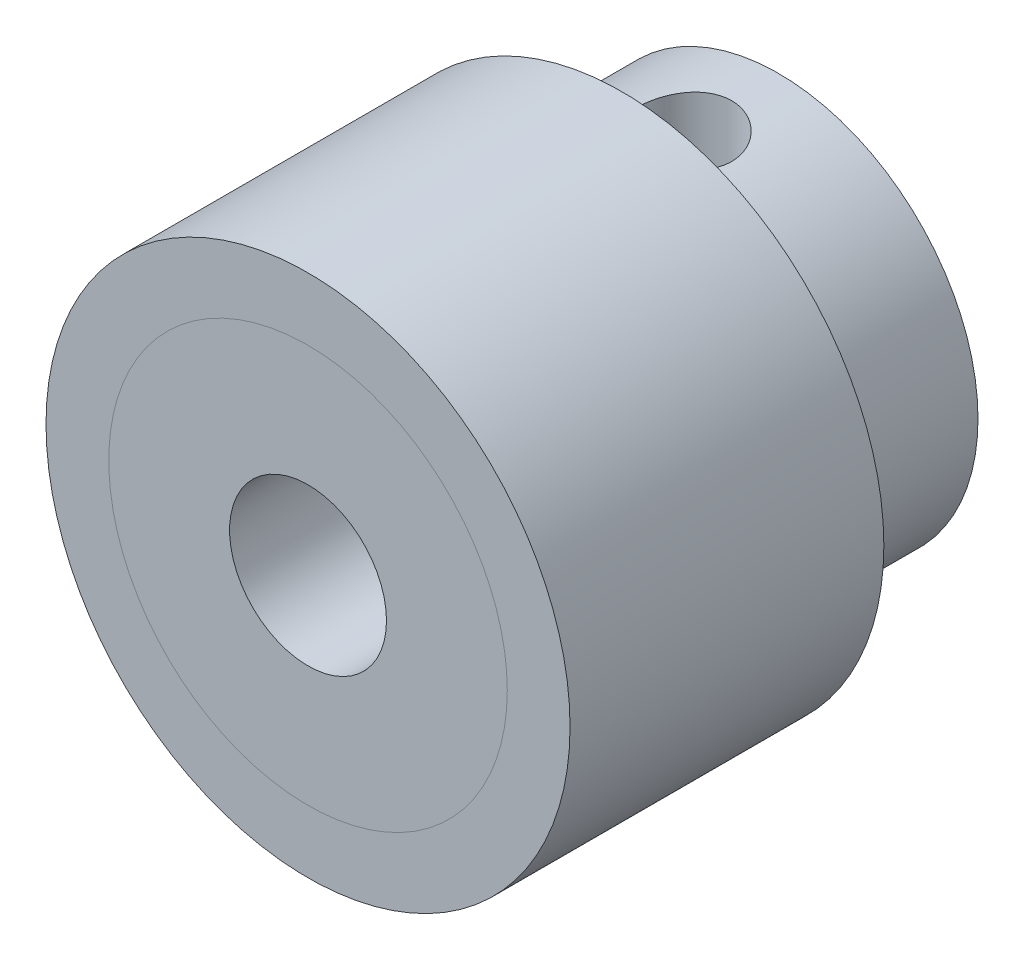
from build123d import *

# Parameters (mm, degrees)
SKETCH1_R           = 6.35
SKETCH1_R_2         = 2.5
BOSS_EXTRUDE1_DEPTH = 15
SKETCH2_R           = 1.5
CUT_EXTRUDE1_DEPTH  = 18.48270574
SKETCH3_R           = 8.35
SKETCH3_R_2         = 6.35
BOSS_EXTRUDE2_DEPTH = 10


with BuildPart() as part:
    # Sketch1 → Boss-Extrude1 (new body)
    with BuildSketch(Plane.XY):
        Circle(SKETCH1_R)
        Circle(SKETCH1_R_2, mode=Mode.SUBTRACT)
    extrude(amount=BOSS_EXTRUDE1_DEPTH)

    # Sketch2 → Cut-Extrude1 (cut, through all)
    with BuildSketch(Plane(origin=(0, 0, 0), x_dir=(1, 0, 0), z_dir=(0, 1, 0))):
        with Locations(Location((0, -3, 0), (0, 0, 90))):
            Circle(SKETCH2_R)
    extrude(amount=CUT_EXTRUDE1_DEPTH, mode=Mode.SUBTRACT)


with BuildPart() as body_2:
    # Sketch3 → Boss-Extrude2 (new body)
    with BuildSketch(Plane.XY.offset(15)):
        Circle(SKETCH3_R)
        Circle(SKETCH3_R_2, mode=Mode.SUBTRACT)
    extrude(amount=-BOSS_EXTRUDE2_DEPTH)


solid = Compound([part.part, body_2.part])
